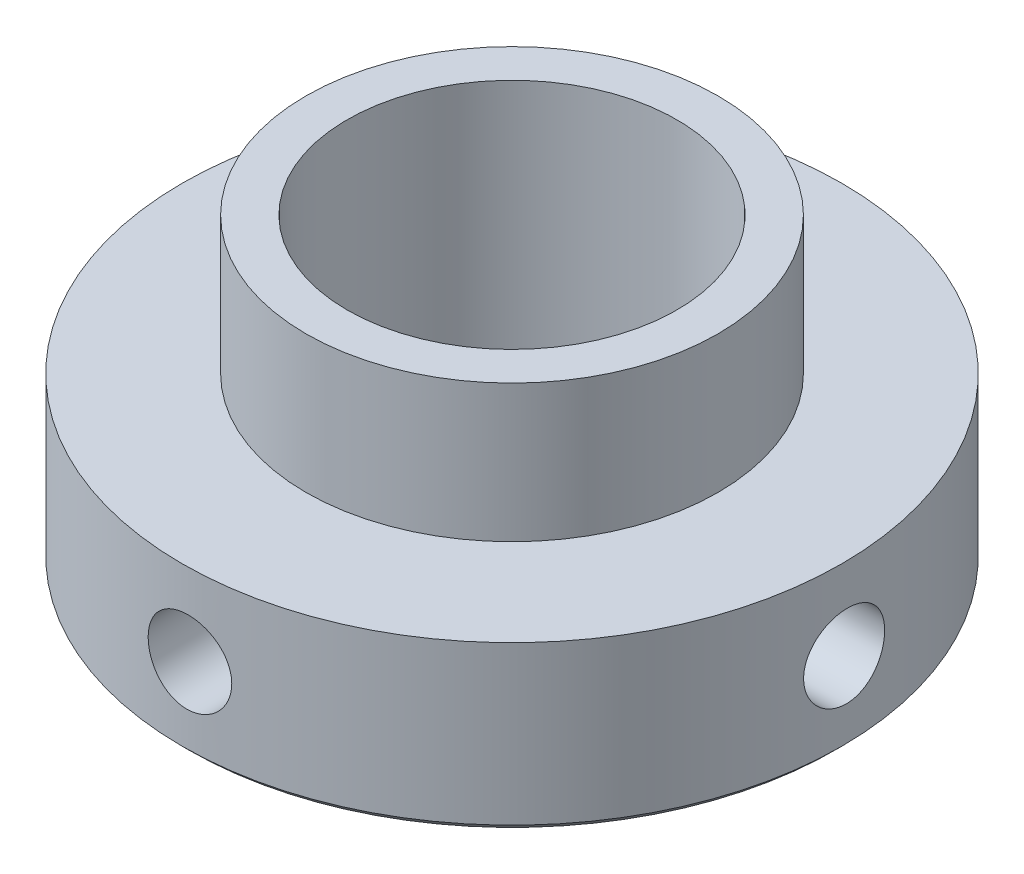
from build123d import *

# Parameters (mm, degrees)
SKETCH1_R               = 3
BOSS_EXTRUDE1_DEPTH     = 0.75
BOSS_EXTRUDE2_START     = 0.75
SKETCH1_3_R             = 1.875
BOSS_EXTRUDE2_DEPTH     = 1.25
CUT_EXTRUDE1_DEPTH      = 5.69041576
CUT_EXTRUDE1_DEPTH_BACK = 5.69041576
SKETCH1_4_R             = 1.5
CIRPATTERN1_COUNT       = 4
CHAMFER1_SIZE           = 0.062


with BuildPart() as part:
    # Sketch1 → Boss-Extrude1 (new, symmetric)
    with BuildSketch(Plane(origin=(0, 0, 0), x_dir=(1, 0, 0), z_dir=(0, 1, 0))):
        Circle(SKETCH1_R)
    extrude(amount=BOSS_EXTRUDE1_DEPTH, both=True)

    # Sketch1<3> → Boss-Extrude2 (add)
    with BuildSketch(Plane(origin=(0, 0, 0), x_dir=(1, 0, 0), z_dir=(0, 1, 0)).offset(BOSS_EXTRUDE2_START)):
        Circle(SKETCH1_3_R)
    extrude(amount=BOSS_EXTRUDE2_DEPTH)

    # Sketch1<4> → Cut-Extrude1 (cut, two sides: drawn at the far end of the back side and taken through both)
    with BuildSketch(Plane(origin=(0, 0, 0), x_dir=(1, 0, 0), z_dir=(0, 1, 0)).offset(-CUT_EXTRUDE1_DEPTH_BACK)):
        Circle(SKETCH1_4_R)
    extrude(amount=CUT_EXTRUDE1_DEPTH + CUT_EXTRUDE1_DEPTH_BACK, mode=Mode.SUBTRACT)

    # Sketch4 → Ø1.0mm Dowel Hole1 (revolve, cut)
    with BuildSketch(Plane(origin=(0.046321233, 0, 2.999642369), x_dir=(0.999880789746526, 0, -0.015440411129998149), z_dir=(0, 1, 0))):
        Polygon((0, 0), (0, 1.525022302), (0.3745, 1.3), (0.3745, 0), align=None)
    f_1_0mm_dowel_hole1 = revolve(axis=Axis((0.144367844, 0, 9.348885384), (-0.015440411129998149, 0, -0.999880789746526)), mode=Mode.SUBTRACT)

    # CirPattern1: Ø1.0mm Dowel Hole1 ×4 about axis
    cirpattern1_axis = Axis((0, 0.75, 0), (0, 1, 0))
    for i in range(1, CIRPATTERN1_COUNT):
        add(f_1_0mm_dowel_hole1.rotate(cirpattern1_axis, i * 360 / CIRPATTERN1_COUNT), mode=Mode.SUBTRACT)

    # Chamfer1
    chamfer1_edges = [part.edges().sort_by_distance(p)[0] for p in [
        (-3, -0.75, 0),
    ]]
    chamfer(chamfer1_edges, length=CHAMFER1_SIZE)


solid = part.part
